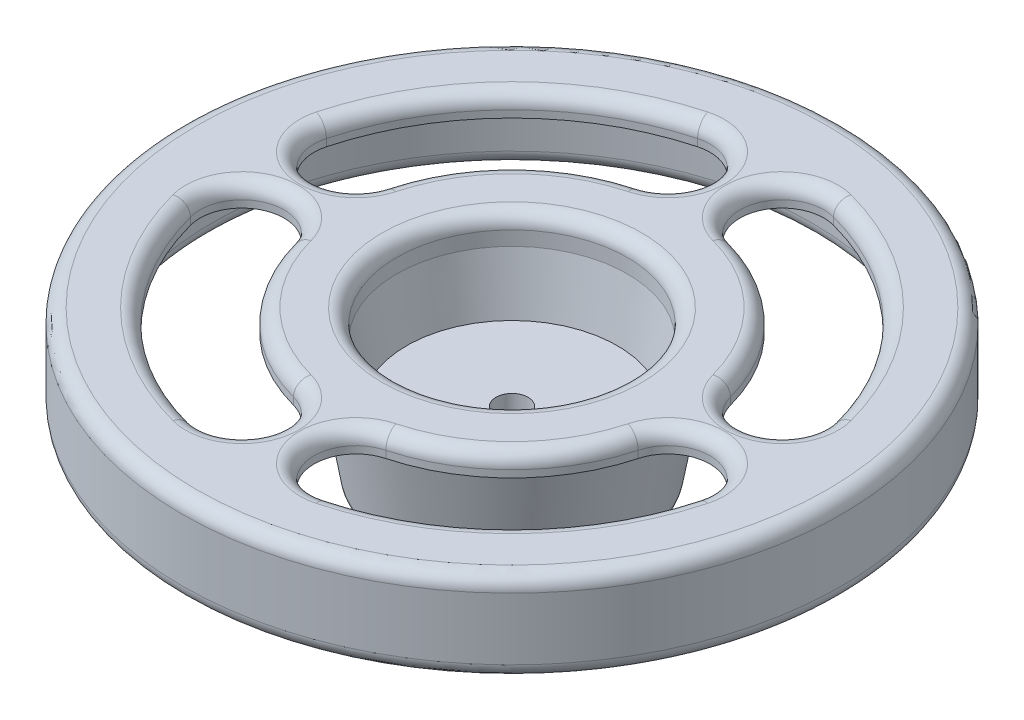
from build123d import *

# Parameters (mm, degrees)
CROQUIS2_R            = 1.125
CORTAR_EXTRUIR1_DEPTH = 34.202521668
CORTAR_EXTRUIR3_DEPTH = 12
REDONDEO1_R           = 1
CROQUIS6_W            = 7.134483034
CROQUIS6_H            = 6
REDONDEO2_R           = 1


with BuildPart() as part:
    # Croquis1 → Revolución1 (revolve)
    with BuildSketch(Plane(origin=(0, 0, 0), x_dir=(0, 0, -1), z_dir=(1, 0, 0))):
        Polygon((-7.385896519, 2), (-8.091204442, 6), (-8.091204442, 8), (-23.091204442, 8), (-23.091204442, -2.75), (-3.25, -2.75), (-3.25, 0), (0, 0), (0, 2), align=None)
    revolve(axis=Axis((0, 2, 0), (0, -1, 0)))

    # Croquis2 → Cortar-Extruir1 (cut, through all)
    with BuildSketch(Plane(origin=(0, 2, 0), x_dir=(1, 0, 0), z_dir=(0, 1, 0))):
        with Locations(Location((0, 0, 0), (0, 0, 270))):
            Circle(CROQUIS2_R)
    extrude(amount=-CORTAR_EXTRUIR1_DEPTH, mode=Mode.SUBTRACT)

    # Croquis3 → Cortar-Revolución1 (revolve, cut)
    with BuildSketch(Plane(origin=(0, 0, 0), x_dir=(0, 0, -1), z_dir=(1, 0, 0)), mode=Mode.PRIVATE) as cortar_revoluci_n1_sk:
        Polygon((-21, -7.5), (-21, 6.5), (-10, 6.5), (-7.53142227, -7.5), align=None)
    revolve(cortar_revoluci_n1_sk.sketch.rotate(Axis((0, -1000, 0), (0, 1, 0)), 180), axis=Axis((0, -1000, 0), (0, 1, 0)), mode=Mode.SUBTRACT)

    # Croquis5 → Cortar-Extruir3 (cut)
    with BuildSketch(Plane(origin=(0, 8, 0), x_dir=(1, 0, 0), z_dir=(0, 1, 0))):
        with BuildLine():
            ThreePointArc((17.766977075, 4.760647159), (13.006329916, 13.006329916), (4.760647159, 17.766977075))
            ThreePointArc((4.760647159, 17.766977075), (1.151490488, 15.683229499), (3.235238064, 12.074072829))
            ThreePointArc((3.235238064, 12.074072829), (8.838834765, 8.838834765), (12.074072829, 3.235238064))
            ThreePointArc((12.074072829, 3.235238064), (15.683229499, 1.151490488), (17.766977075, 4.760647159))
        make_face()
        with BuildLine():
            ThreePointArc((4.760647159, -17.766977075), (13.006329916, -13.006329916), (17.766977075, -4.760647159))
            ThreePointArc((17.766977075, -4.760647159), (15.683229499, -1.151490488), (12.074072829, -3.235238064))
            ThreePointArc((12.074072829, -3.235238064), (8.838834765, -8.838834765), (3.235238064, -12.074072829))
            ThreePointArc((3.235238064, -12.074072829), (1.151490488, -15.683229499), (4.760647159, -17.766977075))
        make_face()
        with BuildLine():
            ThreePointArc((-17.766977075, -4.760647159), (-13.006329916, -13.006329916), (-4.760647159, -17.766977075))
            ThreePointArc((-4.760647159, -17.766977075), (-1.151490488, -15.683229499), (-3.235238064, -12.074072829))
            ThreePointArc((-3.235238064, -12.074072829), (-8.838834765, -8.838834765), (-12.074072829, -3.235238064))
            ThreePointArc((-12.074072829, -3.235238064), (-15.683229499, -1.151490488), (-17.766977075, -4.760647159))
        make_face()
        with BuildLine():
            ThreePointArc((-4.760647159, 17.766977075), (-13.006329916, 13.006329916), (-17.766977075, 4.760647159))
            ThreePointArc((-17.766977075, 4.760647159), (-15.683229499, 1.151490488), (-12.074072829, 3.235238064))
            ThreePointArc((-12.074072829, 3.235238064), (-8.838834765, 8.838834765), (-3.235238064, 12.074072829))
            ThreePointArc((-3.235238064, 12.074072829), (-1.151490488, 15.683229499), (-4.760647159, 17.766977075))
        make_face()
    extrude(amount=-CORTAR_EXTRUIR3_DEPTH, mode=Mode.SUBTRACT)

    # Redondeo1
    redondeo1_edges = [part.edges().sort_by_distance(p)[0] for p in [
        (0, -2.75, 8.368975428),
        (15.683229499, 8, -1.151490488),
        (13.006329916, 8, -13.006329916),
        (1.151490488, 8, -15.683229499),
        (8.838834765, 8, -8.838834765),
        (1.151490488, 8, 15.683229499),
        (13.006329916, 8, 13.006329916),
        (15.683229499, 8, 1.151490488),
        (8.838834765, 8, 8.838834765),
        (-15.683229499, 8, 1.151490488),
        (-13.006329916, 8, 13.006329916),
        (-1.151490488, 8, 15.683229499),
        (-8.838834765, 8, 8.838834765),
        (0, 8, -8.091204442),
        (-1.151490488, 8, -15.683229499),
        (-13.006329916, 8, -13.006329916),
        (-15.683229499, 8, -1.151490488),
        (-8.838834765, 8, -8.838834765),
        (0, 8, -23.091204442),
        (0, -2.75, -3.25),
    ]]
    fillet(redondeo1_edges, radius=REDONDEO1_R)

    # Croquis6 → Cortar-Revolución2 (revolve, cut)
    with BuildSketch(Plane(origin=(0, 0, 0), x_dir=(0, 0, -1), z_dir=(1, 0, 0)), mode=Mode.PRIVATE) as cortar_revoluci_n2_sk:
        with Locations((-19.523962925, -1.349286623)):
            Rectangle(CROQUIS6_W, CROQUIS6_H)
    revolve(cortar_revoluci_n2_sk.sketch.rotate(Axis((0, -1000, 0), (0, 1, 0)), 180), axis=Axis((0, -1000, 0), (0, 1, 0)), mode=Mode.SUBTRACT)

    # Redondeo2
    redondeo2_edges = [part.edges().sort_by_distance(p)[0] for p in [
        (0, 1.650713377, -23.091204442),
        (0, 1.650713377, 21),
    ]]
    fillet(redondeo2_edges, radius=REDONDEO2_R)


solid = part.part
